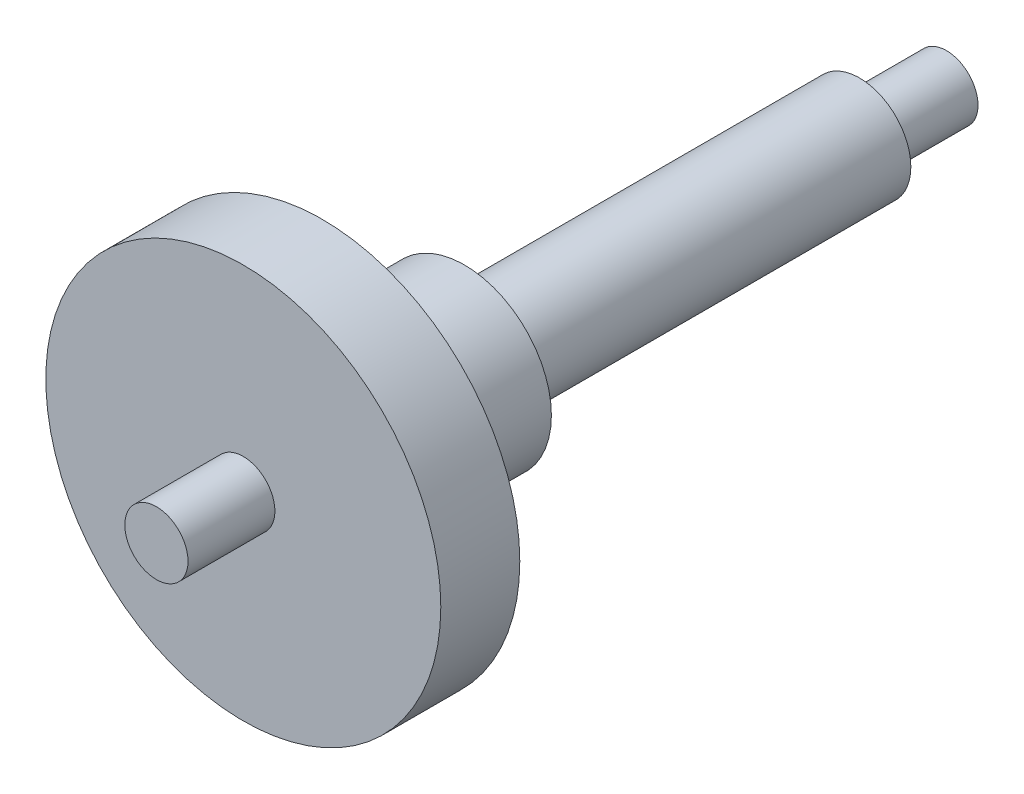
from build123d import *

# Parameters (mm, degrees)
SKETCH1_R           = 0.4
BOSS_EXTRUDE1_DEPTH = 1.1
SKETCH2_R           = 0.65
BOSS_EXTRUDE2_DEPTH = 5
SKETCH3_R           = 1.1
BOSS_EXTRUDE3_DEPTH = 1.8
SKETCH4_R           = 2.5
BOSS_EXTRUDE4_DEPTH = 1
SKETCH5_R           = 0.4
BOSS_EXTRUDE5_DEPTH = 1.1


with BuildPart() as part:
    # Sketch1 → Boss-Extrude1 (new body)
    with BuildSketch(Plane.XY):
        Circle(SKETCH1_R)
    extrude(amount=BOSS_EXTRUDE1_DEPTH)

    # Sketch2 → Boss-Extrude2 (add)
    with BuildSketch(Plane.XY.offset(1.1)):
        Circle(SKETCH2_R)
    extrude(amount=BOSS_EXTRUDE2_DEPTH)

    # Sketch3 → Boss-Extrude3 (add)
    with BuildSketch(Plane.XY.offset(6.1)):
        Circle(SKETCH3_R)
    extrude(amount=BOSS_EXTRUDE3_DEPTH)

    # Sketch4 → Boss-Extrude4 (add)
    with BuildSketch(Plane.XY.offset(7.9)):
        Circle(SKETCH4_R)
    extrude(amount=BOSS_EXTRUDE4_DEPTH)

    # Sketch5 → Boss-Extrude5 (add)
    with BuildSketch(Plane.XY.offset(8.9)):
        Circle(SKETCH5_R)
    extrude(amount=BOSS_EXTRUDE5_DEPTH)


solid = part.part
